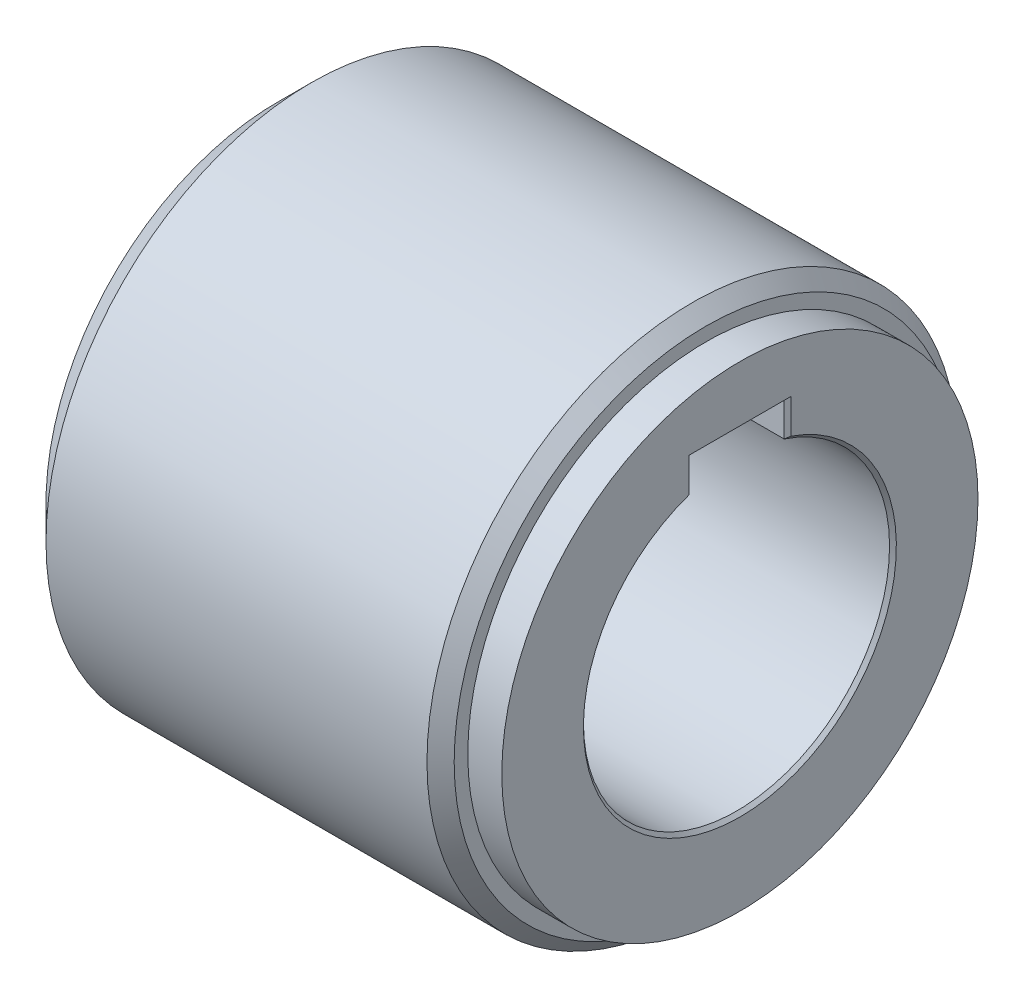
from build123d import *

# Parameters (mm, degrees)
SKETCH_1_R      = 39
EXTRUDE_1_DEPTH = 34
CHAMFER_1_SIZE  = 5
CHAMFER_2_SIZE  = 0.5


with BuildPart() as part:
    # Эскиз1 → Бобышка-Вытянуть1 (new, symmetric)
    with BuildSketch(Plane(origin=(0, 0, 0), x_dir=(0, 0, -1), z_dir=(1, 0, 0))):
        Circle(SKETCH_1_R)
        with BuildLine():
            Line((-7, 26.3), (7, 26.3))
            Line((7, 26.3), (7, 21.38340478))
            ThreePointArc((7, 21.38340478), (0, -22.5), (-7, 21.38340478))
            Line((-7, 21.38340478), (-7, 26.3))
        make_face(mode=Mode.SUBTRACT)
    extrude(amount=EXTRUDE_1_DEPTH, both=True)

    # Фаска1
    chamfer_1_edges = [part.edges().sort_by_distance(p)[0] for p in [
        (-34, 0, 39),
    ]]
    chamfer(chamfer_1_edges, length=CHAMFER_1_SIZE)

    # Фаска2
    chamfer_2_edges = [part.edges().sort_by_distance(p)[0] for p in [
        (34, 26.3, 0),
        (34, 23.84170239, 7),
        (-34, -22.5, 0),
        (-34, 23.84170239, -7),
        (-34, 26.3, 0),
        (-34, 23.84170239, 7),
        (34, -22.5, 0),
        (34, 23.84170239, -7),
    ]]
    chamfer(chamfer_2_edges, length=CHAMFER_2_SIZE)

    # Эскиз2 → Вырез-Повернуть1 (revolve, cut)
    with BuildSketch(Plane.XY, mode=Mode.PRIVATE) as cut_revolve_1_sk:
        Polygon((34, 35), (29, 35), (29, 37), (27, 39), (34, 39), align=None)
    revolve(cut_revolve_1_sk.sketch.rotate(Axis((0, 0, 0), (1, 0, 0)), 90), axis=Axis((0, 0, 0), (1, 0, 0)), mode=Mode.SUBTRACT)


solid = part.part
